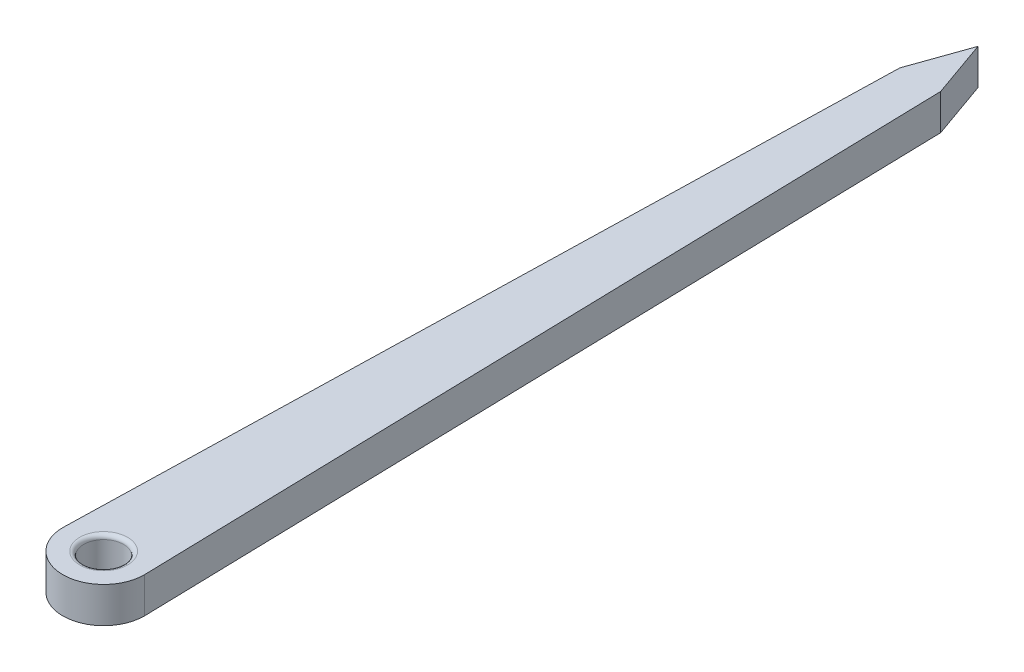
from build123d import *

# Parameters (mm, degrees)
SKICA1_R                 = 1.75
P_IDAT_VYSUNUT_M1_DEPTH  = 3.5
SKICA2_R                 = 1.95
ODEBRAT_VYSUNUT_M1_DEPTH = 100
ZAOBLIT1_R               = 0.4


with BuildPart() as part:
    # Skica1 → Přidat vysunutím1 (new body)
    # profile 1 of 2: a face of its own
    with BuildSketch(Plane(origin=(0, 0, 0), x_dir=(1, 0, 0), z_dir=(0, 1, 0))):
        with BuildLine():
            Line((-2, 80), (-3.995003123, 0.199875078))
            ThreePointArc((-3.995003123, 0.199875078), (0, 4), (3.995003123, 0.199875078))
            Line((3.995003123, 0.199875078), (2, 80))
            Line((2, 80), (0, 85.656854249))
            Line((0, 85.656854249), (-2, 80))
        make_face()
    # profile 2 of 2: a face of its own
    with BuildSketch(Plane(origin=(0, 0, 0), x_dir=(1, 0, 0), z_dir=(0, 1, 0))):
        with BuildLine():
            Line((-3.995003123, 0.199875078), (-4, 0))
            ThreePointArc((-4, 0), (0, -4), (4, 0))
            Line((4, 0), (3.995003123, 0.199875078))
            ThreePointArc((3.995003123, 0.199875078), (0, 4), (-3.995003123, 0.199875078))
        make_face()
        with Locations(Location((0, 0, 0), (0, 0, 270))):
            Circle(SKICA1_R, mode=Mode.SUBTRACT)
    extrude(amount=P_IDAT_VYSUNUT_M1_DEPTH)

    # Skica2 → Odebrat vysunutím1 (cut)
    with BuildSketch(Plane(origin=(0, 3.5, 0), x_dir=(1, 0, 0), z_dir=(0, 1, 0))):
        with Locations(Location((0, 0, 0), (0, 0, 270))):
            Circle(SKICA2_R)
    extrude(amount=-ODEBRAT_VYSUNUT_M1_DEPTH, mode=Mode.SUBTRACT)

    # Zaoblit1
    zaoblit1_edges = [part.edges().sort_by_distance(p)[0] for p in [
        (0, 3.5, -1.95),
    ]]
    fillet(zaoblit1_edges, radius=ZAOBLIT1_R)


solid = part.part
